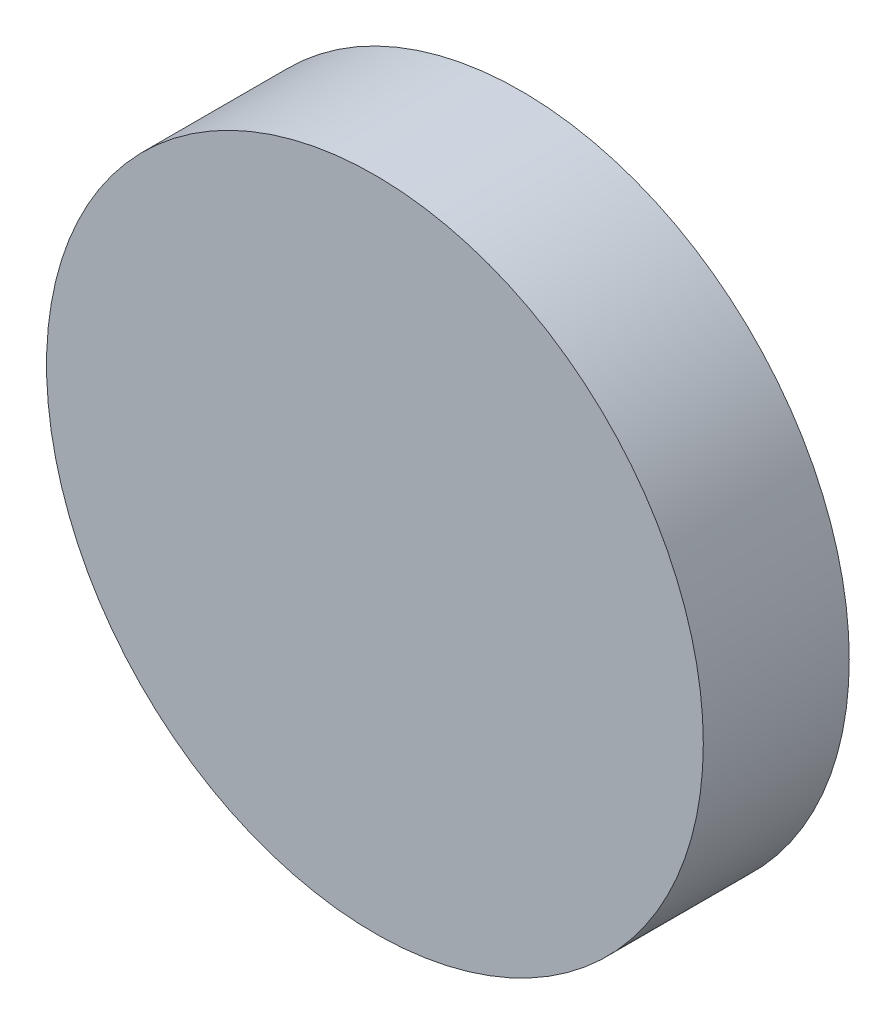
from build123d import *

# Parameters (mm, degrees)
STORE_EVAP_FAN_1_START = -750
SKETCH1_R              = 90
STORE_EVAP_FAN_1_DEPTH = 40


with BuildPart() as part:
    # Sketch1 → STORE_evap_fan_1 (new body)
    with BuildSketch(Plane.XY.offset(STORE_EVAP_FAN_1_START)):
        with Locations((700, 1450)):
            Circle(SKETCH1_R)
    extrude(amount=-STORE_EVAP_FAN_1_DEPTH)


solid = part.part
